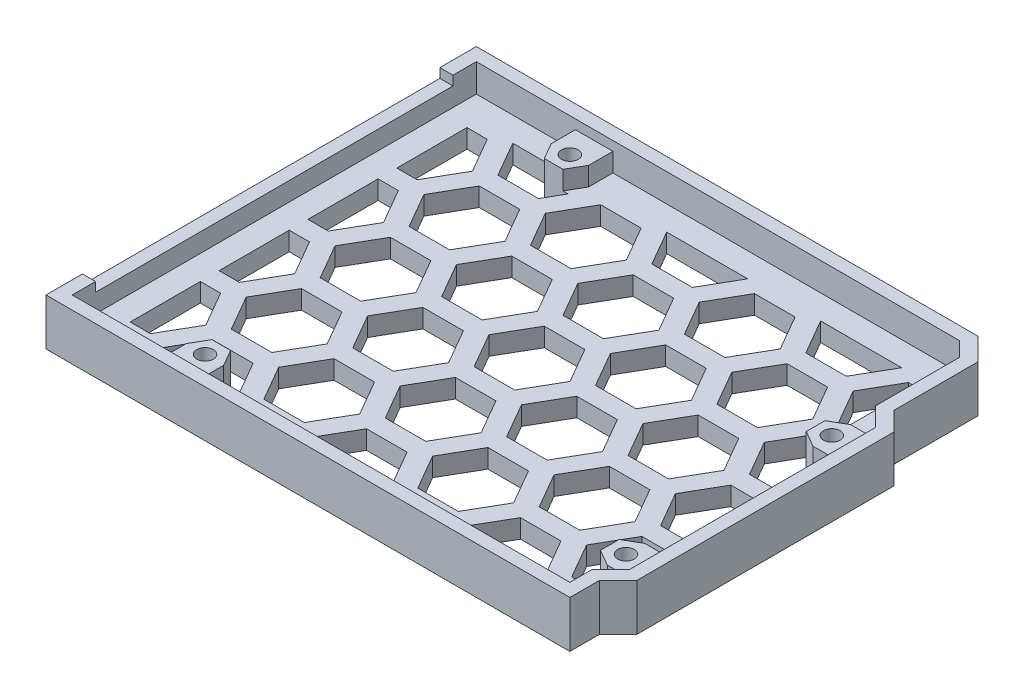
from build123d import *

# Parameters (mm, degrees)
BOSS_EXTRUDE1_DEPTH       = 2.54
CUT_EXTRUDE1_DEPTH        = 91.482486703
BOSS_EXTRUDE2_DEPTH       = 2.54
BOSS_EXTRUDE4_DEPTH       = 2.54
F_4_40_TAPPED_HOLE2_D     = 2.2606
F_4_40_TAPPED_HOLE2_DEPTH = 3.81
F_4_40_TAPPED_HOLE2_TIP   = 0.679152758
BOSS_EXTRUDE3_DEPTH       = 3.81
SKETCH10_W                = 1.778
SKETCH10_H                = 48.514
BOSS_EXTRUDE5_DEPTH       = 2.54


with BuildPart() as part:
    # Sketch1 → Boss-Extrude1 (new body)
    with BuildSketch(Plane(origin=(0, 0, 0), x_dir=(1, 0, 0), z_dir=(0, 1, 0))):
        Polygon((-2.54, 2.54), (65.568102448, 2.54), (68.58, -0.471897552), (68.58, -11.901897552), (71.12, -14.441897552), (71.12, -49.312102448), (68.58, -51.852102448), (68.58, -55.88), (-2.54, -55.88), align=None)
    extrude(amount=BOSS_EXTRUDE1_DEPTH)

    # Sketch2 → Cut-Extrude1 (cut, through all)
    with BuildSketch(Plane(origin=(0, 2.54, 0), x_dir=(1, 0, 0), z_dir=(0, 1, 0))):
        Polygon((5.289630657, -3.81), (2.54, -3.81), (2.54, -13.335), (5.289630657, -13.335), (8.039261314, -8.5725), align=None)
        Polygon((26.18682365, -3.81), (20.687562336, -3.81), (17.937931679, -8.5725), (20.687562336, -13.335), (26.18682365, -13.335), (28.936454307, -8.5725), align=None)
        Polygon((2.54, -15.875), (2.54, -25.4), (5.289630657, -25.4), (8.039261314, -20.6375), (5.289630657, -15.875), align=None)
        Polygon((2.54, -27.94), (2.54, -37.465), (5.289630657, -37.465), (8.039261314, -32.7025), (5.289630657, -27.94), align=None)
        Polygon((7.489335183, -2.54), (10.23896584, -7.3025), (15.738227154, -7.3025), (18.487857811, -2.54), align=None)
        Polygon((2.54, -40.005), (2.54, -49.53), (5.289630657, -49.53), (8.039261314, -44.7675), (5.289630657, -40.005), align=None)
        Polygon((15.738227154, -9.8425), (10.23896584, -9.8425), (7.489335183, -14.605), (10.23896584, -19.3675), (15.738227154, -19.3675), (18.487857811, -14.605), align=None)
        Polygon((7.489335183, -50.8), (18.487857811, -50.8), (15.738227154, -46.0375), (10.23896584, -46.0375), align=None)
        Polygon((28.386528176, -50.8), (39.385050804, -50.8), (36.635420147, -46.0375), (31.136158833, -46.0375), align=None)
        Polygon((28.386528176, -2.54), (31.136158833, -7.3025), (36.635420147, -7.3025), (39.385050804, -2.54), align=None)
        Polygon((49.283721169, -50.8), (60.282243797, -50.8), (57.53261314, -46.0375), (52.033351826, -46.0375), align=None)
        Polygon((47.084016644, -3.81), (41.58475533, -3.81), (38.835124673, -8.5725), (41.58475533, -13.335), (47.084016644, -13.335), (49.833647301, -8.5725), align=None)
        Polygon((63.717897552, -49.53), (66.04, -47.207897552), (66.04, -40.005), (62.481948323, -40.005), (59.732317666, -44.7675), (62.481948323, -49.53), align=None)
        Polygon((49.283721169, -2.54), (52.033351826, -7.3025), (57.53261314, -7.3025), (60.282243797, -2.54), align=None)
        Polygon((66.04, -37.465), (66.04, -27.94), (62.481948323, -27.94), (59.732317666, -32.7025), (62.481948323, -37.465), align=None)
        Polygon((36.635420147, -9.8425), (31.136158833, -9.8425), (28.386528176, -14.605), (31.136158833, -19.3675), (36.635420147, -19.3675), (39.385050804, -14.605), align=None)
        Polygon((63.5, -3.81), (62.481948323, -3.81), (59.732317666, -8.5725), (62.481948323, -13.335), (63.5, -13.335), align=None)
        Polygon((66.04, -25.4), (66.04, -16.546102448), (65.368897552, -15.875), (62.481948323, -15.875), (59.732317666, -20.6375), (62.481948323, -25.4), align=None)
        Polygon((57.53261314, -9.8425), (52.033351826, -9.8425), (49.283721169, -14.605), (52.033351826, -19.3675), (57.53261314, -19.3675), (60.282243797, -14.605), align=None)
        Polygon((26.18682365, -15.875), (20.687562336, -15.875), (17.937931679, -20.6375), (20.687562336, -25.4), (26.18682365, -25.4), (28.936454307, -20.6375), align=None)
        Polygon((36.635420147, -33.9725), (31.136158833, -33.9725), (28.386528176, -38.735), (31.136158833, -43.4975), (36.635420147, -43.4975), (39.385050804, -38.735), align=None)
        Polygon((15.738227154, -21.9075), (10.23896584, -21.9075), (7.489335183, -26.67), (10.23896584, -31.4325), (15.738227154, -31.4325), (18.487857811, -26.67), align=None)
        Polygon((47.084016644, -15.875), (41.58475533, -15.875), (38.835124673, -20.6375), (41.58475533, -25.4), (47.084016644, -25.4), (49.833647301, -20.6375), align=None)
        Polygon((26.18682365, -27.94), (20.687562336, -27.94), (17.937931679, -32.7025), (20.687562336, -37.465), (26.18682365, -37.465), (28.936454307, -32.7025), align=None)
        Polygon((47.084016644, -40.005), (41.58475533, -40.005), (38.835124673, -44.7675), (41.58475533, -49.53), (47.084016644, -49.53), (49.833647301, -44.7675), align=None)
        Polygon((52.033351826, -21.9075), (49.283721169, -26.67), (52.033351826, -31.4325), (57.53261314, -31.4325), (60.282243797, -26.67), (57.53261314, -21.9075), align=None)
        Polygon((15.738227154, -33.9725), (10.23896584, -33.9725), (7.489335183, -38.735), (10.23896584, -43.4975), (15.738227154, -43.4975), (18.487857811, -38.735), align=None)
        Polygon((26.18682365, -40.005), (20.687562336, -40.005), (17.937931679, -44.7675), (20.687562336, -49.53), (26.18682365, -49.53), (28.936454307, -44.7675), align=None)
        Polygon((47.084016644, -27.94), (41.58475533, -27.94), (38.835124673, -32.7025), (41.58475533, -37.465), (47.084016644, -37.465), (49.833647301, -32.7025), align=None)
        Polygon((36.635420147, -21.9075), (31.136158833, -21.9075), (28.386528176, -26.67), (31.136158833, -31.4325), (36.635420147, -31.4325), (39.385050804, -26.67), align=None)
        Polygon((57.53261314, -33.9725), (52.033351826, -33.9725), (49.283721169, -38.735), (52.033351826, -43.4975), (57.53261314, -43.4975), (60.282243797, -38.735), align=None)
    extrude(amount=-CUT_EXTRUDE1_DEPTH, mode=Mode.SUBTRACT)

    # Sketch3 → Boss-Extrude2 (add)
    with BuildSketch(Plane(origin=(0, 2.54, 0), x_dir=(1, 0, 0), z_dir=(0, 1, 0))):
        Polygon((11.43, -50.8), (12.7, -48.600295474), (15.24, -48.600295474), (16.51, -50.8), align=None)
        Polygon((63.840295474, -46.99), (63.840295474, -44.45), (66.04, -43.18), (66.04, -47.3075), (65.372993775, -47.874903776), align=None)
        Polygon((63.840295474, -15.875), (63.840295474, -19.05), (66.04, -20.32), (66.04, -16.546102448), (65.368897552, -15.875), align=None)
        Polygon((12.7, -2.54), (13.97, -4.739704526), (17.217857811, -4.739704526), (18.487857811, -2.54), align=None)
    extrude(amount=-BOSS_EXTRUDE2_DEPTH)

    # Sketch7 → Boss-Extrude4 (add)
    with BuildSketch(Plane(origin=(0, 2.54, 0), x_dir=(1, 0, 0), z_dir=(0, 1, 0))):
        Polygon((11.43, -50.8), (12.7, -48.600295474), (15.24, -48.600295474), (16.51, -50.8), (16.51, -55.88), (11.43, -55.88), align=None)
        Polygon((66.04, -43.18), (71.12, -43.18), (71.12, -48.26), (66.04, -48.26), (63.840295474, -46.99), (63.840295474, -44.45), align=None)
        Polygon((66.04, -20.32), (71.12, -20.32), (71.12, -15.24), (66.04, -15.24), (63.840295474, -16.51), (63.840295474, -19.05), align=None)
        Polygon((12.7, -2.54), (12.7, 2.54), (17.78, 2.54), (17.78, -2.54), (16.51, -4.739704526), (13.97, -4.739704526), align=None)
    extrude(amount=BOSS_EXTRUDE4_DEPTH)

    # #4-40 Tapped Hole2
    with Locations(Plane(origin=(0, 5.08, 0), x_dir=(1, 0, 0), z_dir=(0, 1, 0))):
        with Locations((15.24, -2.54), (66.04, -17.78), (66.04, -45.72), (13.97, -50.8)):
            Hole(F_4_40_TAPPED_HOLE2_D / 2, depth=F_4_40_TAPPED_HOLE2_DEPTH)
            with Locations((0, 0, -(F_4_40_TAPPED_HOLE2_DEPTH + F_4_40_TAPPED_HOLE2_TIP / 2))):  # 118° drill point
                Cone(0, F_4_40_TAPPED_HOLE2_D / 2, F_4_40_TAPPED_HOLE2_TIP, mode=Mode.SUBTRACT)

    # Sketch6 → Boss-Extrude3 (add)
    with BuildSketch(Plane(origin=(0, 2.54, 0), x_dir=(1, 0, 0), z_dir=(0, 1, 0))):
        Polygon((-2.54, -55.88), (68.58, -55.88), (68.58, -51.852102448), (71.12, -49.312102448), (71.12, -14.441897552), (68.58, -11.901897552), (68.58, -0.471897552), (65.568102448, 2.54), (-2.54, 2.54), (-2.54, -2.413), (-0.762, -2.413), (-0.762, 0.762), (64.831630735, 0.762), (66.802, -1.208369265), (66.802, -12.638369265), (69.342, -15.178369265), (69.342, -48.575630735), (66.802, -51.115630735), (66.802, -54.102), (-0.762, -54.102), (-0.762, -50.927), (-2.54, -50.927), align=None)
    extrude(amount=BOSS_EXTRUDE3_DEPTH)

    # Sketch10 → Boss-Extrude5 (add)
    with BuildSketch(Plane(origin=(0, 2.54, 0), x_dir=(1, 0, 0), z_dir=(0, 1, 0))):
        with Locations((-1.651, -26.67)):
            Rectangle(SKETCH10_W, SKETCH10_H)
    extrude(amount=BOSS_EXTRUDE5_DEPTH)


solid = part.part
